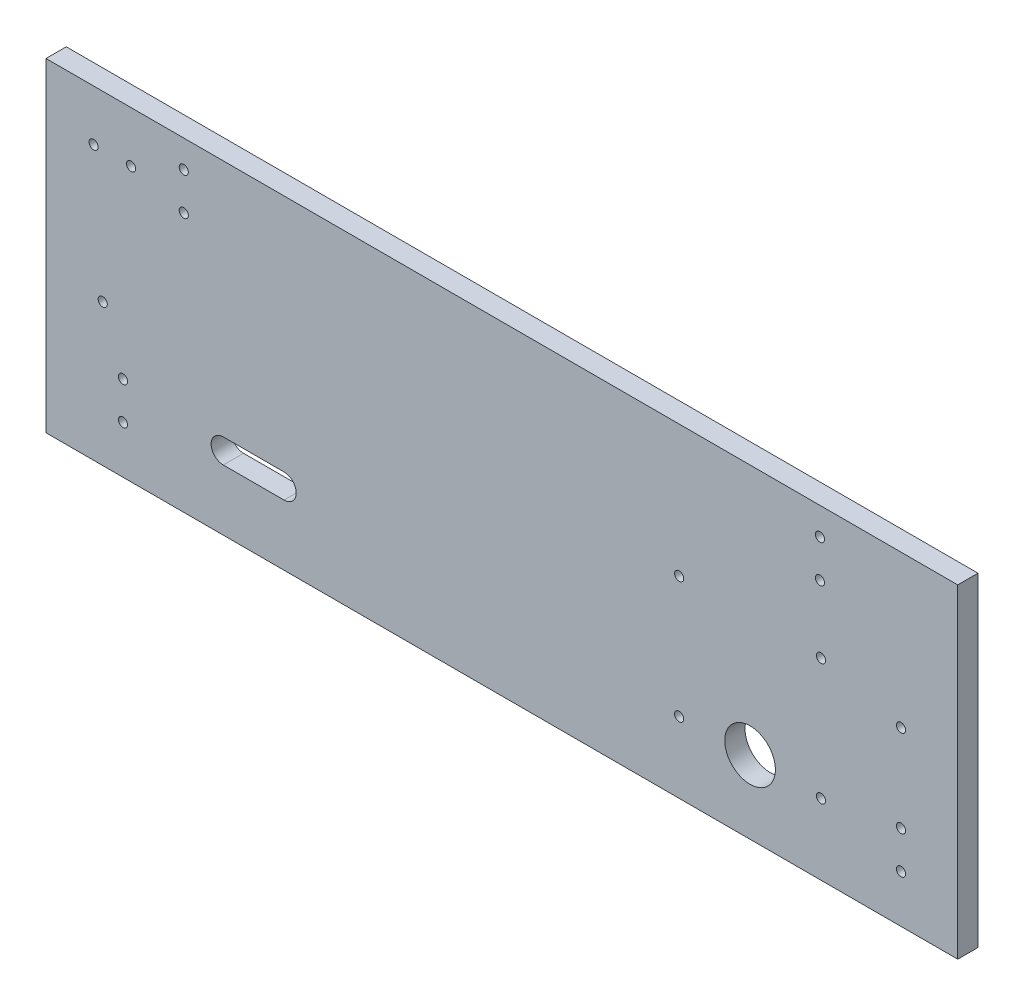
from build123d import *

# Parameters (mm, degrees)
SCHIZZO1_W                   = 450
SCHIZZO1_H                   = 160
ESTRUSIONE_ESTRUSIONE1_DEPTH = 10
SCHIZZO2_R                   = 12.5
SCHIZZO2_R_2                 = 2.25
TAGLIO_ESTRUSIONE1_DEPTH     = 10


with BuildPart() as part:
    # Schizzo1 → Estrusione-Estrusione1 (new body)
    with BuildSketch(Plane.XY):
        with Locations((225, 80)):
            Rectangle(SCHIZZO1_W, SCHIZZO1_H)
    extrude(amount=ESTRUSIONE_ESTRUSIONE1_DEPTH)

    # Schizzo2 → Taglio-Estrusione1 (cut)
    with BuildSketch(Plane.XY.offset(10)):
        with Locations((347.5, 36)):
            Circle(SCHIZZO2_R)
        with Locations((382, 146.5)):
            Circle(SCHIZZO2_R_2)
        with Locations((382, 128)):
            Circle(SCHIZZO2_R_2)
        with Locations((68, 146.5)):
            Circle(SCHIZZO2_R_2)
        with Locations((68, 128)):
            Circle(SCHIZZO2_R_2)
        with Locations((38, 42)):
            Circle(SCHIZZO2_R_2)
        with Locations((38, 23.5)):
            Circle(SCHIZZO2_R_2)
        with Locations((422, 23.5)):
            Circle(SCHIZZO2_R_2)
        with Locations((422, 42)):
            Circle(SCHIZZO2_R_2)
        with Locations((23.5, 134.933694222)):
            Circle(SCHIZZO2_R_2)
        with Locations((42, 134.933694222)):
            Circle(SCHIZZO2_R_2)
        with Locations((28, 70)):
            Circle(SCHIZZO2_R_2)
        with Locations((422, 85)):
            Circle(SCHIZZO2_R_2)
        with Locations((312.5, 95)):
            Circle(SCHIZZO2_R_2)
        with Locations((382.5, 95)):
            Circle(SCHIZZO2_R_2)
        with Locations((382.5, 35)):
            Circle(SCHIZZO2_R_2)
        with Locations((312.5, 35)):
            Circle(SCHIZZO2_R_2)
        with BuildLine():
            Line((87.5, 42), (117.5, 42))
            ThreePointArc((117.5, 42), (123.5, 36), (117.5, 30))
            Line((117.5, 30), (87.5, 30))
            ThreePointArc((87.5, 30), (81.5, 36), (87.5, 42))
        make_face()
    extrude(amount=-TAGLIO_ESTRUSIONE1_DEPTH, mode=Mode.SUBTRACT)


solid = part.part
